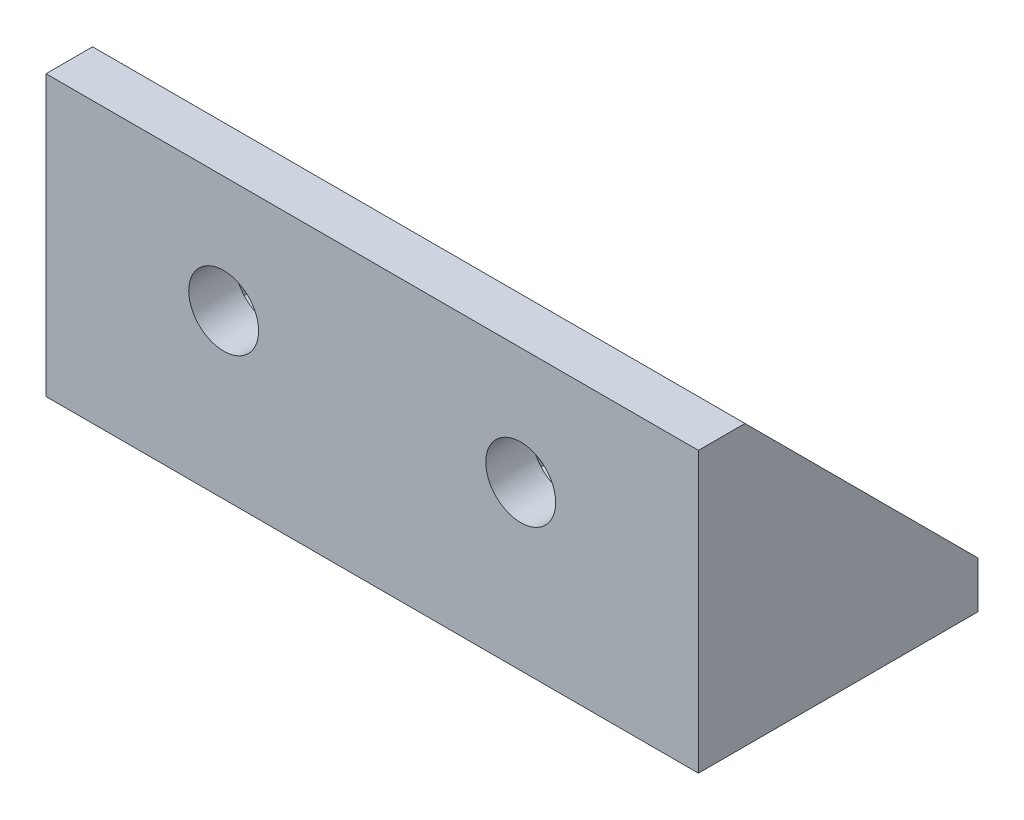
from build123d import *

# Parameters (mm, degrees)
CROQUIS1_R                   = 2.5
SALIENTE_EXTRUIR1_DEPTH      = 4
CROQUIS2_W                   = 50
CROQUIS2_H                   = 4
SALIENTE_EXTRUIR2_DEPTH      = 20
SALIENTE_EXTRUIR3_DEPTH      = 3
SALIENTE_EXTRUIR3_DEPTH_BACK = 53
CROQUIS4_W                   = 20.5
CROQUIS4_H                   = 20
CORTAR_EXTRUIR1_DEPTH        = 20
CROQUIS5_R                   = 3
CORTAR_EXTRUIR2_DEPTH        = 17
CROQUIS6_R                   = 3
CORTAR_EXTRUIR3_DEPTH        = 20


with BuildPart() as part:
    # Croquis1 → Saliente-Extruir1 (new body)
    with BuildSketch(Plane(origin=(0, 0, 0), x_dir=(1, 0, 0), z_dir=(0, 1, 0))):
        Polygon((0, 0), (0, 20), (50, 20), (50, 0), (50, -4), (0, -4), align=None)
        with Locations(Location((12.5, 10, 0), (0, 0, 270))):
            Circle(CROQUIS1_R, mode=Mode.SUBTRACT)
        with Locations(Location((37.5, 10, 0), (0, 0, 270))):
            Circle(CROQUIS1_R, mode=Mode.SUBTRACT)
    extrude(amount=SALIENTE_EXTRUIR1_DEPTH)

    # Croquis2 → Saliente-Extruir2 (add)
    with BuildSketch(Plane(origin=(0, 4, 0), x_dir=(1, 0, 0), z_dir=(0, 1, 0))):
        with Locations((25, -2)):
            Rectangle(CROQUIS2_W, CROQUIS2_H)
    extrude(amount=SALIENTE_EXTRUIR2_DEPTH)

    # Croquis3 → Saliente-Extruir3 (add, two sides: drawn at the far end of the back side and taken through both)
    with BuildSketch(Plane.ZY.offset(-SALIENTE_EXTRUIR3_DEPTH_BACK)):
        Polygon((-20, 4), (-20, 0), (4, 0), (4, 24), (0, 24), align=None)
    extrude(amount=SALIENTE_EXTRUIR3_DEPTH + SALIENTE_EXTRUIR3_DEPTH_BACK)

    # Croquis4 → Cortar-Extruir1 (cut)
    with BuildSketch(Plane(origin=(0, 0, -20), x_dir=(-1, 0, 0), z_dir=(0, 0, -1))):
        with Locations((-37.75, 14)):
            Rectangle(CROQUIS4_W, CROQUIS4_H)
        with Locations((-12.25, 14)):
            Rectangle(CROQUIS4_W, CROQUIS4_H)
    extrude(amount=-CORTAR_EXTRUIR1_DEPTH, mode=Mode.SUBTRACT)

    # Croquis5 → Cortar-Extruir2 (cut)
    with BuildSketch(Plane(origin=(0, 0, 0), x_dir=(-1, 0, 0), z_dir=(0, 0, -1))):
        with Locations((-37.75, 14)):
            Circle(CROQUIS5_R)
        with Locations((-12.25, 14)):
            Circle(CROQUIS5_R)
    extrude(amount=-CORTAR_EXTRUIR2_DEPTH, mode=Mode.SUBTRACT)

    # Croquis6 → Cortar-Extruir3 (cut)
    with BuildSketch(Plane(origin=(0, 4, 0), x_dir=(1, 0, 0), z_dir=(0, 1, 0))):
        with Locations(Location((12.25, 10, 0), (0, 0, 180))):
            Circle(CROQUIS6_R)
        with Locations(Location((37.75, 10, 0), (0, 0, 270))):
            Circle(CROQUIS6_R)
    extrude(amount=-CORTAR_EXTRUIR3_DEPTH, mode=Mode.SUBTRACT)


solid = part.part
